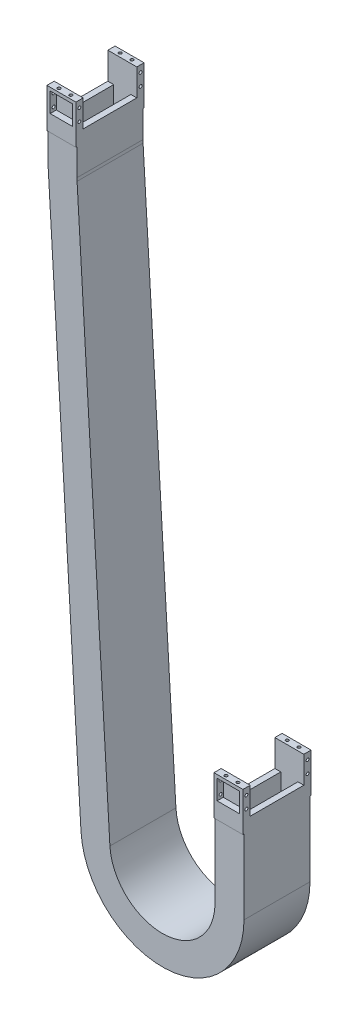
from build123d import *

# Parameters (mm, degrees)
SKETCH2_W           = 54
SKETCH2_H           = 123
SKETCH2_W_2         = 32
SKETCH2_H_2         = 100
SKETCH12_W          = 54
SKETCH12_H          = 123
SKETCH12_W_2        = 32
SKETCH12_H_2        = 100
BOSS_EXTRUDE1_DEPTH = 1
SKETCH3_W           = 54
SKETCH3_H           = 127
SKETCH3_W_2         = 32
SKETCH3_H_2         = 100
EXTRUDE1_DEPTH      = 73
EXTRUDE2_START      = -54
SKETCH4_R           = 2.75
SKETCH4_W           = 100
SKETCH4_H           = 50
EXTRUDE2_DEPTH      = 54
SKETCH7_W           = 54
SKETCH7_H           = 127
SKETCH7_W_2         = 32
SKETCH7_H_2         = 100
EXTRUDE5_DEPTH      = 73
EXTRUDE6_REACH      = 1082.845
SKETCH8_R           = 2.75
SKETCH8_W           = 100
SKETCH8_H           = 50
SKETCH5_W           = 42
SKETCH5_H           = 36.5
EXTRUDE3_DEPTH      = 11.5
SKETCH6_W           = 42
SKETCH6_H           = 36.5
EXTRUDE4_DEPTH      = 11.5
SKETCH9_R           = 2.75
EXTRUDE7_DEPTH      = 7
SKETCH10_R          = 2.75
EXTRUDE8_DEPTH      = 7


with BuildPart() as part:
    # Sweep1: sweep along a path in Sketch1
    with BuildLine(Plane.XY) as sweep1_path:
        Line((-311.2, 954.5), (-311.2, 904.5))
        ThreePointArc((-311.2, 904.5), (-311.146227919, 900.833921861), (-310.984957937, 897.170997845))
        Line((-310.984957937, 897.170997845), (-249.784957937, -144.831619147))
        ThreePointArc((-249.784957937, -144.831619147), (-121.333921861, -262.44884491), (0, -137.502616992))
        Line((0, -137.502616992), (0, 0))
    # Sketch2 → Sweep1 (sweep)
    with BuildSketch(Plane(origin=(0, 0, 0), x_dir=(1, 0, 0), z_dir=(0, 1, 0))):
        with Locations((0, -61.5)):
            Rectangle(SKETCH2_W, SKETCH2_H)
        with Locations((0, -61.5)):
            Rectangle(SKETCH2_W_2, SKETCH2_H_2, mode=Mode.SUBTRACT)
    sweep(path=sweep1_path.line)

    # Sketch12 → Boss-Extrude1 (add)
    with BuildSketch(Plane(origin=(0, 0, 0), x_dir=(1, 0, 0), z_dir=(0, 1, 0))):
        with Locations((0, -61.5)):
            Rectangle(SKETCH12_W, SKETCH12_H)
        with Locations((0, -61.5)):
            Rectangle(SKETCH12_W_2, SKETCH12_H_2, mode=Mode.SUBTRACT)
    extrude(amount=BOSS_EXTRUDE1_DEPTH)

    # Sketch3 → Extrude1 (add)
    with BuildSketch(Plane(origin=(0, 1, 0), x_dir=(1, 0, 0), z_dir=(0, 1, 0))):
        with Locations((0, -61.5)):
            Rectangle(SKETCH3_W, SKETCH3_H)
        with Locations((0, -61.5)):
            Rectangle(SKETCH3_W_2, SKETCH3_H_2, mode=Mode.SUBTRACT)
    extrude(amount=EXTRUDE1_DEPTH)

    # Sketch4 → Extrude2 (cut)
    with BuildSketch(Plane(origin=(27, 0, 0), x_dir=(0, 0, -1), z_dir=(1, 0, 0)).offset(EXTRUDE2_START)):
        with Locations((-118.5, 61.5)):
            Circle(SKETCH4_R)
        with Locations((-118.5, 39)):
            Circle(SKETCH4_R)
        with Locations((-4.5, 39)):
            Circle(SKETCH4_R)
        with Locations((-4.5, 61.5)):
            Circle(SKETCH4_R)
        with Locations((-61.5, 49)):
            Rectangle(SKETCH4_W, SKETCH4_H)
    extrude(amount=EXTRUDE2_DEPTH, mode=Mode.SUBTRACT)

    # Sketch7 → Extrude5 (add)
    with BuildSketch(Plane(origin=(0, 954.5, 0), x_dir=(1, 0, 0), z_dir=(0, 1, 0))):
        with Locations((-311.2, -61.5)):
            Rectangle(SKETCH7_W, SKETCH7_H)
        with Locations((-311.2, -61.5)):
            Rectangle(SKETCH7_W_2, SKETCH7_H_2, mode=Mode.SUBTRACT)
    extrude(amount=EXTRUDE5_DEPTH)

    # Extrude6: up to this face of the body (flat: up to its plane)
    extrude6_end = Plane(part.part.faces().sort_by_distance((-338.2, 966.473380455, 61.5))[0])
    # Sketch8 → Extrude6 (cut, up to the picked face)
    with BuildSketch(Plane(origin=(-284.2, 0, 0), x_dir=(0, 0, -1), z_dir=(1, 0, 0)), mode=Mode.PRIVATE) as extrude6_sk1:
        with Locations((-4.5, 992.5)):
            Circle(SKETCH8_R)
    extrude6_tool1 = split(extrude(extrude6_sk1.sketch, amount=-EXTRUDE6_REACH, mode=Mode.PRIVATE), bisect_by=extrude6_end, keep=Keep.BOTH, mode=Mode.PRIVATE)
    # Sketch8 → Extrude6 (cut, up to the picked face)
    with BuildSketch(Plane(origin=(-284.2, 0, 0), x_dir=(0, 0, -1), z_dir=(1, 0, 0)), mode=Mode.PRIVATE) as extrude6_sk2:
        with Locations((-4.5, 1015)):
            Circle(SKETCH8_R)
    extrude6_tool2 = split(extrude(extrude6_sk2.sketch, amount=-EXTRUDE6_REACH, mode=Mode.PRIVATE), bisect_by=extrude6_end, keep=Keep.BOTH, mode=Mode.PRIVATE)
    # Sketch8 → Extrude6 (cut, up to the picked face)
    with BuildSketch(Plane(origin=(-284.2, 0, 0), x_dir=(0, 0, -1), z_dir=(1, 0, 0)), mode=Mode.PRIVATE) as extrude6_sk3:
        with Locations((-118.5, 992.5)):
            Circle(SKETCH8_R)
    extrude6_tool3 = split(extrude(extrude6_sk3.sketch, amount=-EXTRUDE6_REACH, mode=Mode.PRIVATE), bisect_by=extrude6_end, keep=Keep.BOTH, mode=Mode.PRIVATE)
    # Sketch8 → Extrude6 (cut, up to the picked face)
    with BuildSketch(Plane(origin=(-284.2, 0, 0), x_dir=(0, 0, -1), z_dir=(1, 0, 0)), mode=Mode.PRIVATE) as extrude6_sk4:
        with Locations((-118.5, 1015)):
            Circle(SKETCH8_R)
    extrude6_tool4 = split(extrude(extrude6_sk4.sketch, amount=-EXTRUDE6_REACH, mode=Mode.PRIVATE), bisect_by=extrude6_end, keep=Keep.BOTH, mode=Mode.PRIVATE)
    # Sketch8 → Extrude6 (cut, up to the picked face)
    with BuildSketch(Plane(origin=(-284.2, 0, 0), x_dir=(0, 0, -1), z_dir=(1, 0, 0)), mode=Mode.PRIVATE) as extrude6_sk5:
        with Locations((-61.5, 1002.5)):
            Rectangle(SKETCH8_W, SKETCH8_H)
    extrude6_tool5 = split(extrude(extrude6_sk5.sketch, amount=-EXTRUDE6_REACH, mode=Mode.PRIVATE), bisect_by=extrude6_end, keep=Keep.BOTH, mode=Mode.PRIVATE)
    add(extrude6_tool1.solids().sort_by(Axis((-284.2, 992.5, 4.5), (-1, 0, 0)))[0], mode=Mode.SUBTRACT)
    add(extrude6_tool2.solids().sort_by(Axis((-284.2, 1015, 4.5), (-1, 0, 0)))[0], mode=Mode.SUBTRACT)
    add(extrude6_tool3.solids().sort_by(Axis((-284.2, 992.5, 118.5), (-1, 0, 0)))[0], mode=Mode.SUBTRACT)
    add(extrude6_tool4.solids().sort_by(Axis((-284.2, 1015, 118.5), (-1, 0, 0)))[0], mode=Mode.SUBTRACT)
    add(extrude6_tool5.solids().sort_by(Axis((-284.2, 1002.5, 61.5), (-1, 0, 0)))[0], mode=Mode.SUBTRACT)

    # Sketch5 → Extrude3 (cut)
    with BuildSketch(Plane.XY.offset(125)):
        with Locations((0, 49.75)):
            Rectangle(SKETCH5_W, SKETCH5_H)
        with Locations((-311.2, 1003.25)):
            Rectangle(SKETCH5_W, SKETCH5_H)
    extrude(amount=-EXTRUDE3_DEPTH, mode=Mode.SUBTRACT)

    # Sketch6 → Extrude4 (cut)
    with BuildSketch(Plane(origin=(0, 0, -2), x_dir=(-1, 0, 0), z_dir=(0, 0, -1))):
        with Locations((0, 49.75)):
            Rectangle(SKETCH6_W, SKETCH6_H)
        with Locations((311.2, 1003.25)):
            Rectangle(SKETCH6_W, SKETCH6_H)
    extrude(amount=-EXTRUDE4_DEPTH, mode=Mode.SUBTRACT)

    # Sketch9 → Extrude7 (cut)
    with BuildSketch(Plane(origin=(0, 74, 0), x_dir=(1, 0, 0), z_dir=(0, 1, 0))):
        with Locations(Location((-11, -118.5, 0), (0, 0, 180))):
            Circle(SKETCH9_R)
        with Locations(Location((11, -118.5, 0), (0, 0, 180))):
            Circle(SKETCH9_R)
        with Locations(Location((11, -4.5, 0), (0, 0, 180))):
            Circle(SKETCH9_R)
        with Locations(Location((-11, -4.5, 0), (0, 0, 180))):
            Circle(SKETCH9_R)
    extrude(amount=-EXTRUDE7_DEPTH, mode=Mode.SUBTRACT)

    # Sketch10 → Extrude8 (cut)
    with BuildSketch(Plane(origin=(0, 1027.5, 0), x_dir=(1, 0, 0), z_dir=(0, 1, 0))):
        with Locations(Location((-322.2, -118.5, 0), (0, 0, 270))):
            Circle(SKETCH10_R)
        with Locations(Location((-300.2, -118.5, 0), (0, 0, 270))):
            Circle(SKETCH10_R)
        with Locations(Location((-322.2, -4.5, 0), (0, 0, 270))):
            Circle(SKETCH10_R)
        with Locations(Location((-300.2, -4.5, 0), (0, 0, 270))):
            Circle(SKETCH10_R)
    extrude(amount=-EXTRUDE8_DEPTH, mode=Mode.SUBTRACT)


solid = part.part
